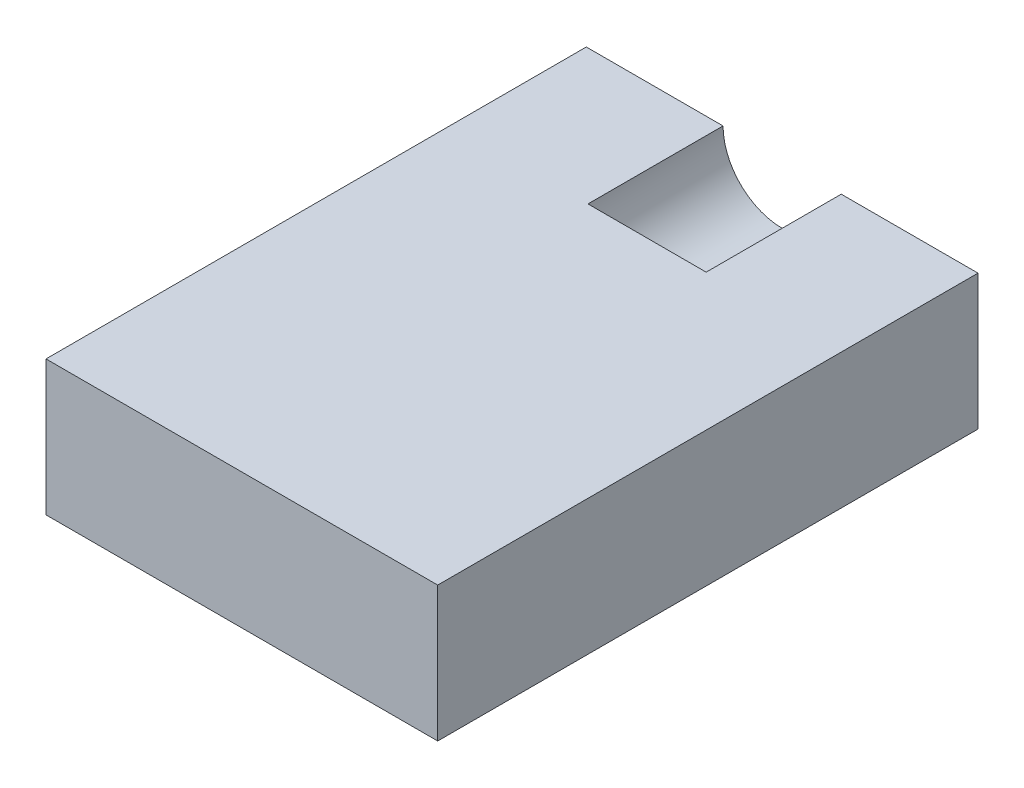
from build123d import *

# Parameters (mm, degrees)
SKETCH1_W           = 36.83
SKETCH1_H           = 12.7
BOSS_EXTRUDE1_DEPTH = 50.8
SKETCH3_R           = 5.55625
CUT_EXTRUDE1_DEPTH  = 12.7


with BuildPart() as part:
    # Sketch1 → Boss-Extrude1 (new body)
    with BuildSketch(Plane.XY):
        Rectangle(SKETCH1_W, SKETCH1_H)
    extrude(amount=BOSS_EXTRUDE1_DEPTH)

    # Sketch3 → Cut-Extrude1 (cut)
    with BuildSketch(Plane.XY):
        with Locations((0, 6.35)):
            Circle(SKETCH3_R)
    extrude(amount=CUT_EXTRUDE1_DEPTH, mode=Mode.SUBTRACT)


solid = part.part
